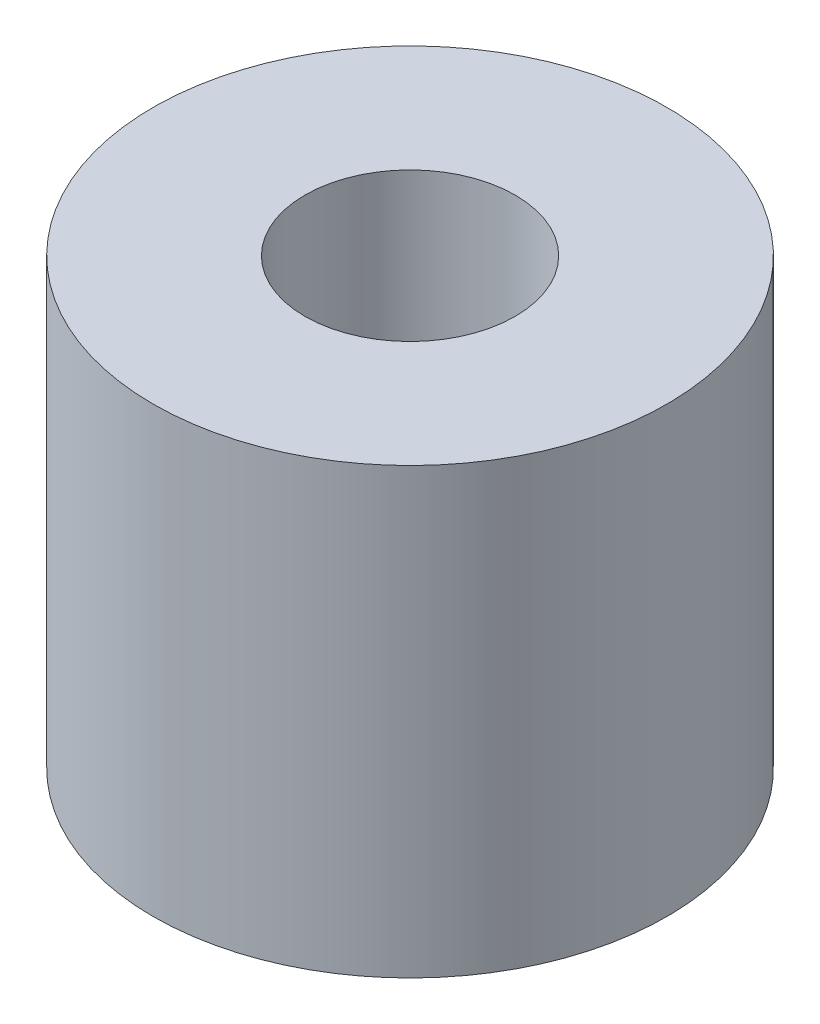
from build123d import *

# Parameters (mm, degrees)
SKETCH1_R           = 11
SKETCH1_R_2         = 4.5
BOSS_EXTRUDE1_DEPTH = 19


with BuildPart() as part:
    # Sketch1 → Boss-Extrude1 (new body)
    with BuildSketch(Plane(origin=(0, 0, 0), x_dir=(1, 0, 0), z_dir=(0, 1, 0))):
        with Locations(Location((0, 0, 0), (0, 0, 270))):
            Circle(SKETCH1_R)
        with Locations(Location((0, 0, 0), (0, 0, 270))):
            Circle(SKETCH1_R_2, mode=Mode.SUBTRACT)
    extrude(amount=BOSS_EXTRUDE1_DEPTH)


solid = part.part
